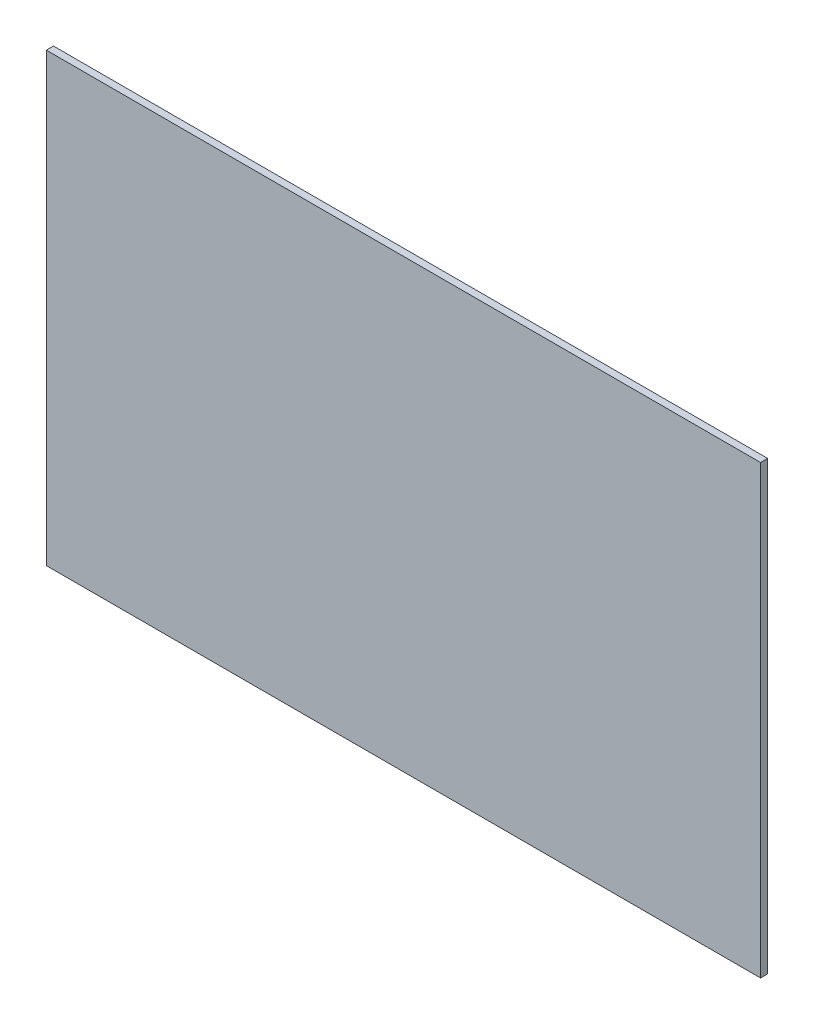
from build123d import *

# Parameters (mm, degrees)
SKETCH1_W           = 50.8
SKETCH1_H           = 31.75
BOSS_EXTRUDE1_DEPTH = 0.508


with BuildPart() as part:
    # Sketch1 → Boss-Extrude1 (new body)
    with BuildSketch(Plane.XY):
        with Locations((25.4, 15.875)):
            Rectangle(SKETCH1_W, SKETCH1_H)
    extrude(amount=BOSS_EXTRUDE1_DEPTH)


solid = part.part
